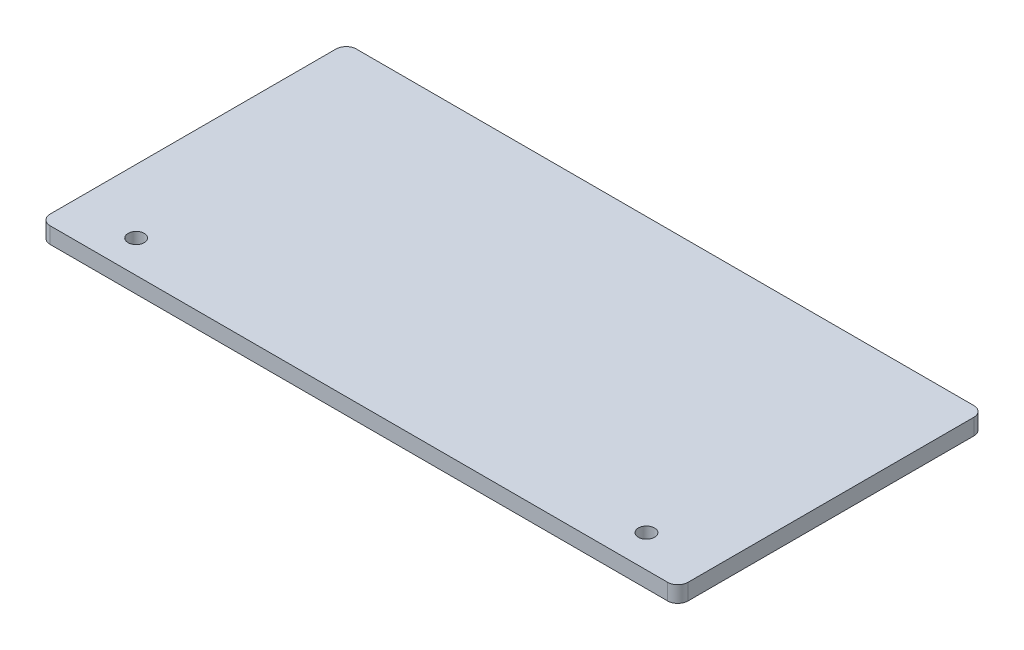
from build123d import *

# Parameters (mm, degrees)
SKETCH1_R           = 1.5875
BOSS_EXTRUDE1_DEPTH = 3.175


with BuildPart() as part:
    # Sketch1 → Boss-Extrude1 (new body)
    with BuildSketch(Plane(origin=(0, 0, 0), x_dir=(1, 0, 0), z_dir=(0, 1, 0))):
        with BuildLine():
            Line((-60.5, 0), (60.5, 0))
            ThreePointArc((60.5, 0), (61.914213562, -0.585786438), (62.5, -2))
            Line((62.5, -2), (62.5, -58))
            ThreePointArc((62.5, -58), (61.914213562, -59.414213562), (60.5, -60))
            Line((60.5, -60), (-60.5, -60))
            ThreePointArc((-60.5, -60), (-61.914213562, -59.414213562), (-62.5, -58))
            Line((-62.5, -58), (-62.5, -2))
            ThreePointArc((-62.5, -2), (-61.914213562, -0.585786438), (-60.5, 0))
        make_face()
        with Locations(Location((-50, -53.65, 0), (0, 0, 270))):
            Circle(SKETCH1_R, mode=Mode.SUBTRACT)
        with Locations(Location((50, -53.65, 0), (0, 0, 270))):
            Circle(SKETCH1_R, mode=Mode.SUBTRACT)
    extrude(amount=BOSS_EXTRUDE1_DEPTH)


solid = part.part
